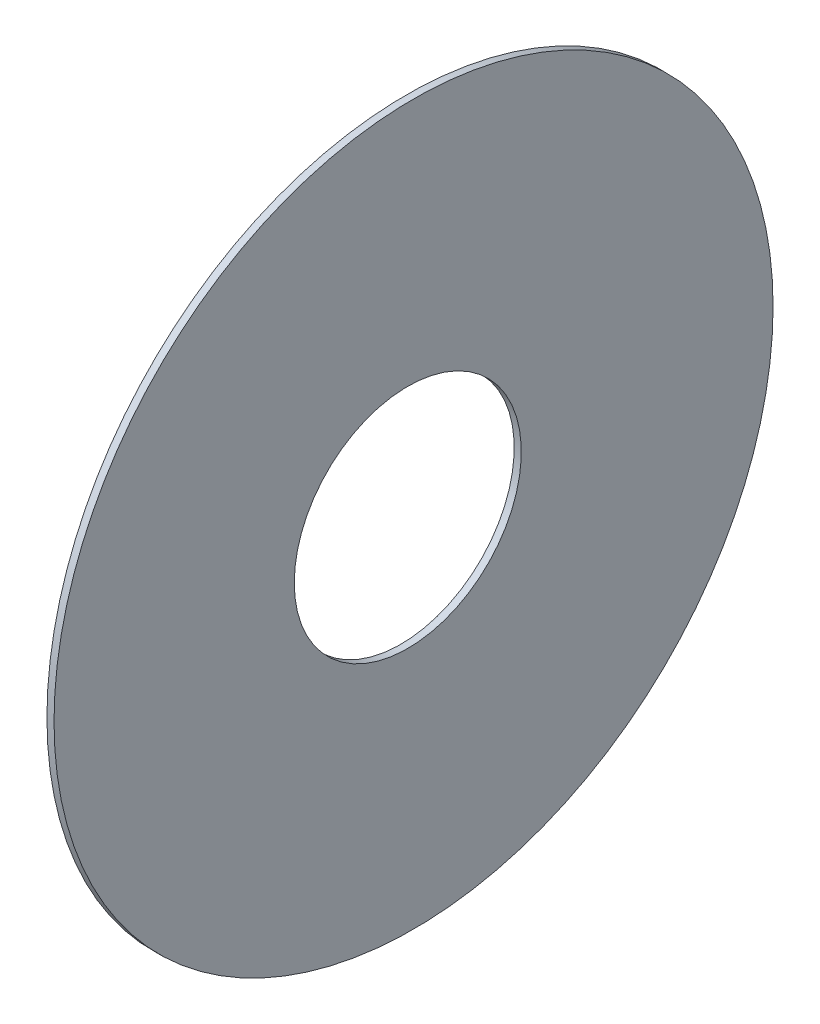
from build123d import *

# Parameters (mm, degrees)
SKETCH1_R           = 241.3
SKETCH1_R_2         = 76.2
BOSS_EXTRUDE1_DEPTH = 4.7625


with BuildPart() as part:
    # Sketch1 → Boss-Extrude1 (new body)
    with BuildSketch(Plane(origin=(0, 0, 0), x_dir=(0, 0, -1), z_dir=(1, 0, 0))):
        with Locations(Location((3.869822907, 0, 0), (0, 0, 180))):
            Circle(SKETCH1_R)
        with Locations(Location((0, 0, 0), (0, 0, 180))):
            Circle(SKETCH1_R_2, mode=Mode.SUBTRACT)
    extrude(amount=BOSS_EXTRUDE1_DEPTH)


solid = part.part
